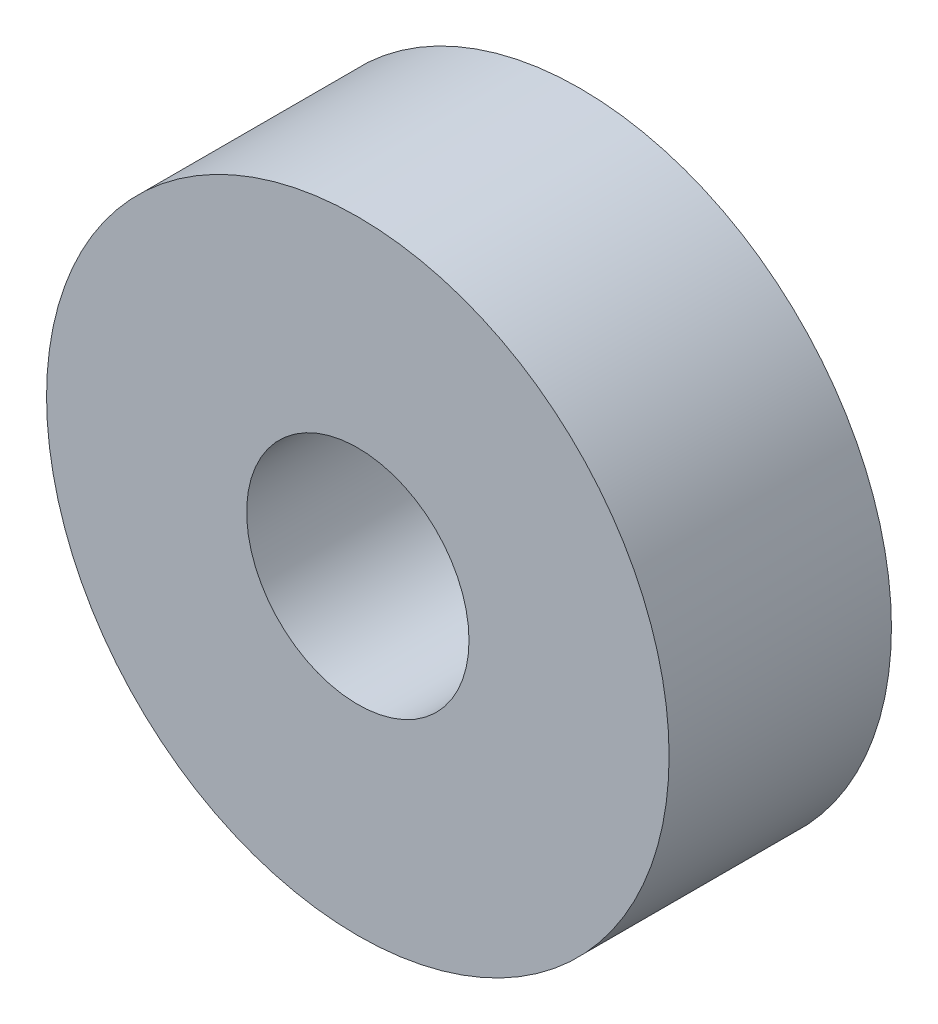
from build123d import *

# Parameters (mm, degrees)
SCHIZZO1_R                   = 7
SCHIZZO1_R_2                 = 2.5
ESTRUSIONE_ESTRUSIONE1_DEPTH = 5


with BuildPart() as part:
    # Schizzo1 → Estrusione-Estrusione1 (new body)
    with BuildSketch(Plane.XY):
        Circle(SCHIZZO1_R)
        Circle(SCHIZZO1_R_2, mode=Mode.SUBTRACT)
    extrude(amount=ESTRUSIONE_ESTRUSIONE1_DEPTH)


solid = part.part
